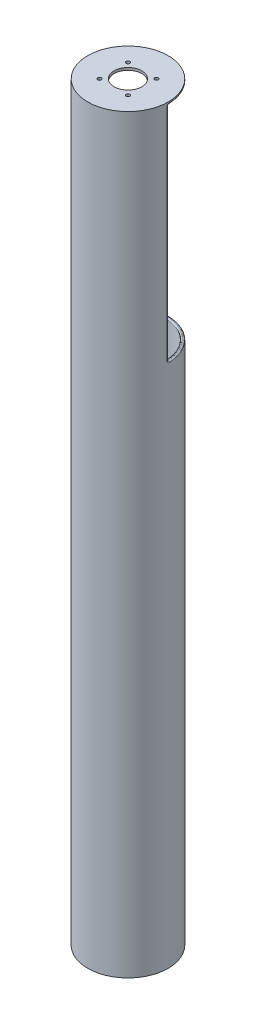
from build123d import *

# Parameters (mm, degrees)
SKETCH_1_R          = 32.5
SKETCH_1_R_2        = 30
EXTRUDE_1_DEPTH     = 340
SKETCH_2_R          = 32.5
EXTRUDE_2_DEPTH     = 5
SKETCH_8_R          = 1.5
CUT_EXTRUDE_2_DEPTH = 5
SKETCH_9_R          = 32.5
SKETCH_9_R_2        = 30
EXTRUDE_3_DEPTH     = 260
SKETCH_10_R         = 32.5
EXTRUDE_4_DEPTH     = 2
CUT_EXTRUDE_3_DEPTH = 2
SKETCH_14_W         = 65
SKETCH_14_H         = 180
CUT_EXTRUDE_4_DEPTH = 32.5
FILLET_1_R          = 1


with BuildPart() as part:
    # 草图1 → 凸台-拉伸1 (new body)
    with BuildSketch(Plane(origin=(0, 0, 0), x_dir=(1, 0, 0), z_dir=(0, 1, 0))):
        with Locations(Location((0, 0, 0), (0, 0, 270))):
            Circle(SKETCH_1_R)
        with Locations(Location((0, 0, 0), (0, 0, 270))):
            Circle(SKETCH_1_R_2, mode=Mode.SUBTRACT)
    extrude(amount=EXTRUDE_1_DEPTH)

    # 草图2 → 凸台-拉伸2 (add)
    with BuildSketch(Plane(origin=(0, 340, 0), x_dir=(1, 0, 0), z_dir=(0, 1, 0))):
        with Locations(Location((0, 0, 0), (0, 0, 270))):
            Circle(SKETCH_2_R)
    extrude(amount=EXTRUDE_2_DEPTH)

    # 草图8 → 切除-拉伸2 (cut)
    with BuildSketch(Plane(origin=(0, 345, 0), x_dir=(1, 0, 0), z_dir=(0, 1, 0))):
        with Locations(Location((-13.1, 0, 0), (0, 0, 270))):
            Circle(SKETCH_8_R)
        with Locations(Location((13.1, 0, 0), (0, 0, 270))):
            Circle(SKETCH_8_R)
        with BuildLine():
            Line((10.3, -10.1), (10.3, 10.1))
            ThreePointArc((10.3, 10.1), (9.854035247, 11.427915792), (8.696945136, 12.217464641))
            ThreePointArc((8.696945136, 12.217464641), (8.401311956, 12.279268479), (8.1, 12.3))
            Line((8.1, 12.3), (-8.1, 12.3))
            ThreePointArc((-8.1, 12.3), (-8.401311956, 12.279268479), (-8.696945136, 12.217464641))
            ThreePointArc((-8.696945136, 12.217464641), (-9.854035247, 11.427915792), (-10.3, 10.1))
            Line((-10.3, 10.1), (-10.3, -10.1))
            ThreePointArc((-10.3, -10.1), (-9.854035247, -11.427915792), (-8.696945136, -12.217464641))
            ThreePointArc((-8.696945136, -12.217464641), (-8.401311956, -12.279268479), (-8.1, -12.3))
            Line((-8.1, -12.3), (8.1, -12.3))
            ThreePointArc((8.1, -12.3), (8.401311956, -12.279268479), (8.696945136, -12.217464641))
            ThreePointArc((8.696945136, -12.217464641), (9.854035247, -11.427915792), (10.3, -10.1))
        make_face()
    extrude(amount=-CUT_EXTRUDE_2_DEPTH, mode=Mode.SUBTRACT)

    # 草图9 → 凸台-拉伸3 (add)
    with BuildSketch(Plane(origin=(0, 345, 0), x_dir=(1, 0, 0), z_dir=(0, 1, 0))):
        with Locations(Location((0, 0, 0), (0, 0, 270))):
            Circle(SKETCH_9_R)
        with Locations(Location((0, 0, 0), (0, 0, 270))):
            Circle(SKETCH_9_R_2, mode=Mode.SUBTRACT)
    extrude(amount=EXTRUDE_3_DEPTH)

    # 草图10 → 凸台-拉伸4 (add)
    with BuildSketch(Plane(origin=(0, 605, 0), x_dir=(1, 0, 0), z_dir=(0, 1, 0))):
        with Locations(Location((0, 0, 0), (0, 0, 270))):
            Circle(SKETCH_10_R)
    extrude(amount=EXTRUDE_4_DEPTH)

    # 草图12 → 切除-拉伸3 (cut)
    with BuildSketch(Plane(origin=(0, 607, 0), x_dir=(1, 0, 0), z_dir=(0, 1, 0))):
        with BuildLine():
            ThreePointArc((12.95, 11.5), (11.5, 12.95), (10.05, 11.5))
            ThreePointArc((10.05, 11.5), (11.5, 10.05), (12.95, 11.5))
        make_face()
        with BuildLine():
            ThreePointArc((12.95, -11.5), (11.5, -10.05), (10.05, -11.5))
            ThreePointArc((10.05, -11.5), (11.5, -12.95), (12.95, -11.5))
        make_face()
        with BuildLine():
            ThreePointArc((11.2, 0), (0, 11.2), (-11.2, 0))
            ThreePointArc((-11.2, 0), (0, -11.2), (11.2, 0))
        make_face()
        with BuildLine():
            ThreePointArc((-10.05, -11.5), (-11.5, -10.05), (-12.95, -11.5))
            ThreePointArc((-12.95, -11.5), (-11.5, -12.95), (-10.05, -11.5))
        make_face()
        with BuildLine():
            ThreePointArc((-10.05, 11.5), (-11.5, 12.95), (-12.95, 11.5))
            ThreePointArc((-12.95, 11.5), (-11.5, 10.05), (-10.05, 11.5))
        make_face()
    extrude(amount=-CUT_EXTRUDE_3_DEPTH, mode=Mode.SUBTRACT)

    # 草图14 → 切除-拉伸4 (cut)
    with BuildSketch(Plane.XY):
        with Locations((0, 515)):
            Rectangle(SKETCH_14_W, SKETCH_14_H)
    extrude(amount=-CUT_EXTRUDE_4_DEPTH, mode=Mode.SUBTRACT)

    # 圆角1
    fillet_1_edges = [part.edges().sort_by_distance(p)[0] for p in [
        (0, 425, -32.5),
        (-30, 515, 0),
        (30, 515, 0),
        (-31.25, 605, 0),
        (-32.5, 515, 0),
        (-31.25, 425, 0),
        (0, 605, -32.5),
        (31.25, 425, 0),
        (32.5, 515, 0),
        (31.25, 605, 0),
        (21.213203436, 605, 21.213203436),
        (0, 425, -30),
    ]]
    fillet(fillet_1_edges, radius=FILLET_1_R)


solid = part.part
